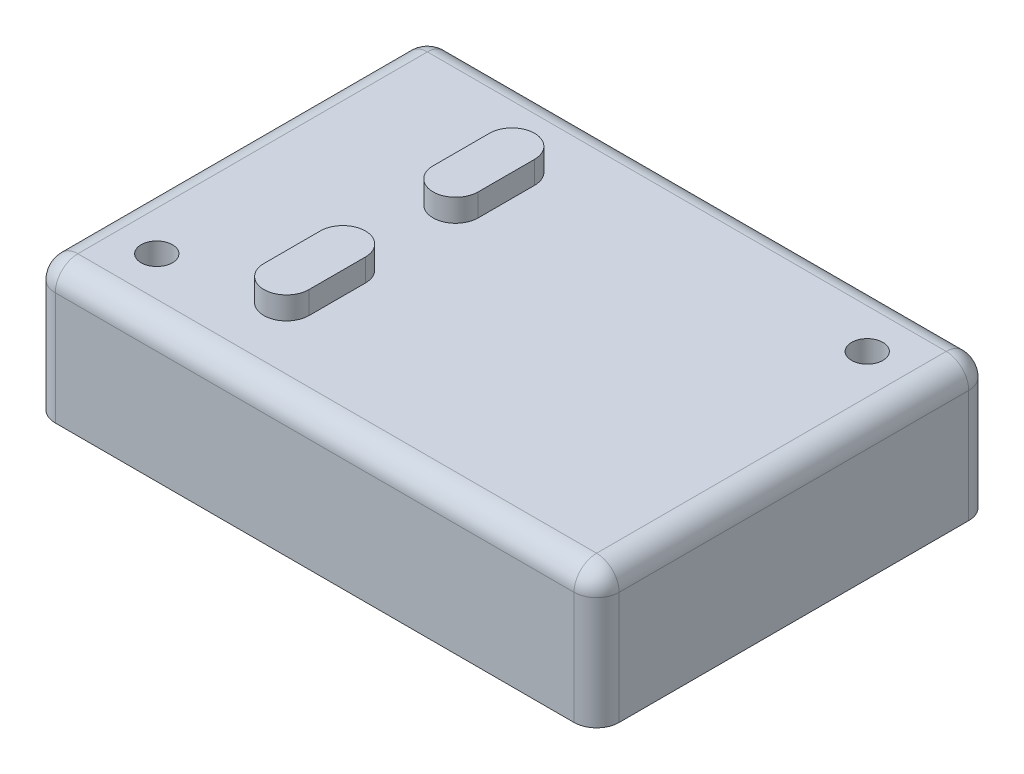
from build123d import *

# Parameters (mm, degrees)
SKETCH1_W           = 50
SKETCH1_H           = 35
BOSS_EXTRUDE1_DEPTH = 12
BOSS_EXTRUDE2_DEPTH = 2
FILLET1_R           = 2
SKETCH4_R           = 1.39
CUT_EXTRUDE1_DEPTH  = 34.574543928


with BuildPart() as part:
    # Sketch1 → Boss-Extrude1 (new body)
    with BuildSketch(Plane(origin=(0, 0, 0), x_dir=(1, 0, 0), z_dir=(0, 1, 0))):
        Rectangle(SKETCH1_W, SKETCH1_H)
    extrude(amount=BOSS_EXTRUDE1_DEPTH)

    # Sketch2 → Boss-Extrude2 (add)
    with BuildSketch(Plane(origin=(0, 12, 0), x_dir=(1, 0, 0), z_dir=(0, 1, 0))):
        with BuildLine():
            Line((-8, 10), (-8, 5))
            ThreePointArc((-8, 5), (-10, 3), (-12, 5))
            Line((-12, 5), (-12, 10))
            ThreePointArc((-12, 10), (-10, 12), (-8, 10))
        make_face()
        with BuildLine():
            Line((-8, -5), (-8, -10))
            ThreePointArc((-8, -10), (-10, -12), (-12, -10))
            Line((-12, -10), (-12, -5))
            ThreePointArc((-12, -5), (-10, -3), (-8, -5))
        make_face()
    extrude(amount=BOSS_EXTRUDE2_DEPTH)

    # Fillet1
    fillet1_edges = [part.edges().sort_by_distance(p)[0] for p in [
        (-25, 12, 0),
        (0, 12, 17.5),
        (25, 12, 0),
        (0, 12, -17.5),
        (25, 6, 17.5),
        (-25, 6, 17.5),
        (-25, 6, -17.5),
        (25, 6, -17.5),
    ]]
    fillet(fillet1_edges, radius=FILLET1_R)

    # Sketch4 → Cut-Extrude1 (cut, through all)
    with BuildSketch(Plane.XZ):
        with Locations(Location((-19.5, 12, 0), (0, 0, 270))):
            Circle(SKETCH4_R)
        with Locations(Location((19.5, -12, 0), (0, 0, 270))):
            Circle(SKETCH4_R)
    extrude(amount=-CUT_EXTRUDE1_DEPTH, mode=Mode.SUBTRACT)


solid = part.part
